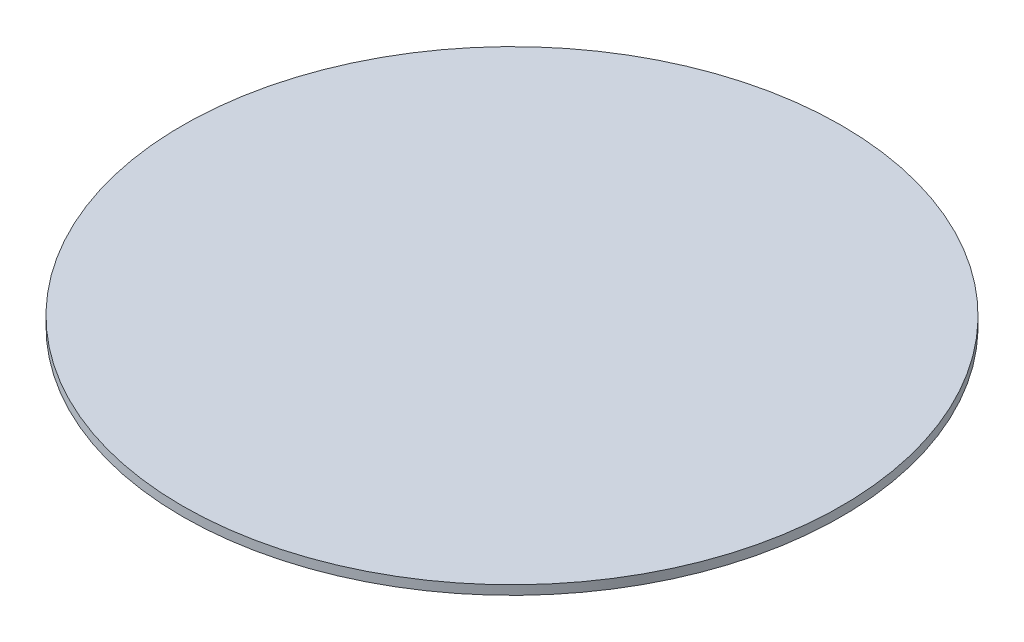
from build123d import *

# Parameters (mm, degrees)
SKETCH1_R           = 107.5
BOSS_EXTRUDE1_DEPTH = 3


with BuildPart() as part:
    # Sketch1 → Boss-Extrude1 (new body)
    with BuildSketch(Plane(origin=(0, 0, 0), x_dir=(1, 0, 0), z_dir=(0, 1, 0))):
        with Locations(Location((0, 0, 0), (0, 0, 270))):
            Circle(SKETCH1_R)
    extrude(amount=BOSS_EXTRUDE1_DEPTH)


solid = part.part
